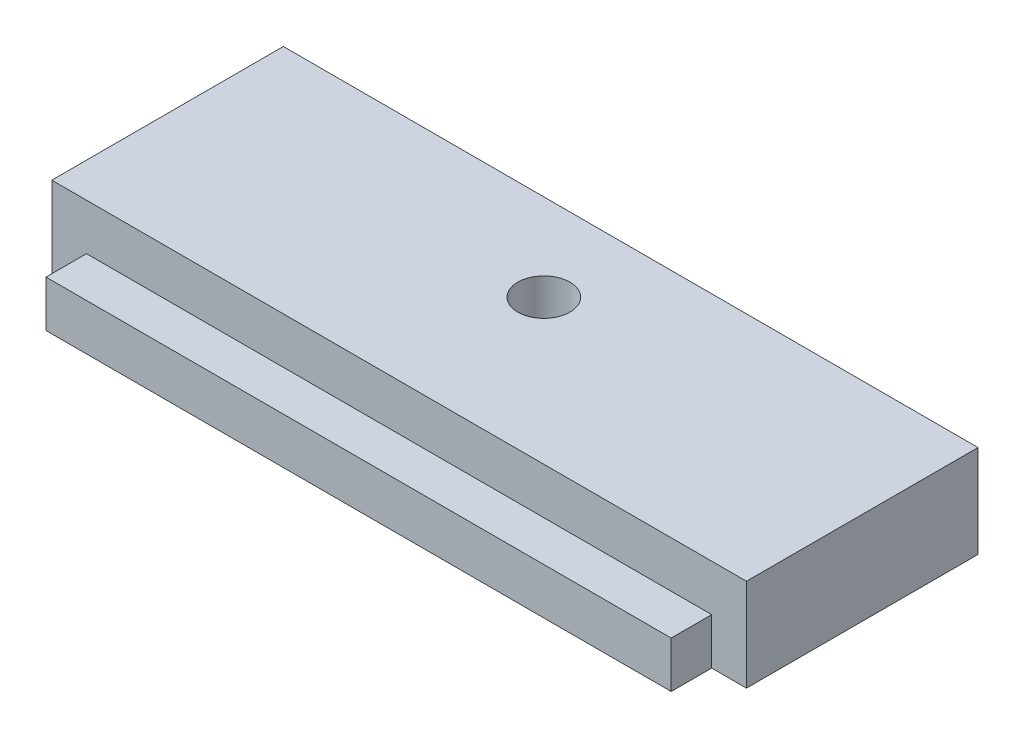
from build123d import *

# Parameters (mm, degrees)
SKETCH_1_W          = 54
SKETCH_1_H          = 4
EXTRUDE_2_DEPTH     = 3.5
SKETCH_2_W          = 60
SKETCH_2_H          = 11
EXTRUDE_3_DEPTH     = 5
SKETCH_3_W          = 60
SKETCH_3_H          = 3
CUT_EXTRUDE_1_DEPTH = 10
SKETCH_4_W          = 60
SKETCH_4_H          = 8
EXTRUDE_4_DEPTH     = 15
SKETCH_5_R          = 2.25
CUT_EXTRUDE_2_DEPTH = 64.749509802


with BuildPart() as part:
    # 스케치1 → 보스-돌출2 (new body)
    with BuildSketch(Plane.XY):
        with Locations((30, 2)):
            Rectangle(SKETCH_1_W, SKETCH_1_H)
    extrude(amount=EXTRUDE_2_DEPTH)

    # 스케치2 → 보스-돌출3 (add)
    with BuildSketch(Plane(origin=(0, 0, 0), x_dir=(-1, 0, 0), z_dir=(0, 0, -1))):
        with Locations((-30, 2.5)):
            Rectangle(SKETCH_2_W, SKETCH_2_H)
    extrude(amount=EXTRUDE_3_DEPTH)

    # 스케치3 → 컷-돌출1 (cut)
    with BuildSketch(Plane.XY):
        with Locations((30, -1.5)):
            Rectangle(SKETCH_3_W, SKETCH_3_H)
    extrude(amount=-CUT_EXTRUDE_1_DEPTH, mode=Mode.SUBTRACT)

    # 스케치4 → 보스-돌출4 (add)
    with BuildSketch(Plane(origin=(0, 0, -5), x_dir=(-1, 0, 0), z_dir=(0, 0, -1))):
        with Locations((-30, 4)):
            Rectangle(SKETCH_4_W, SKETCH_4_H)
    extrude(amount=EXTRUDE_4_DEPTH)

    # 스케치5 → 컷-돌출2 (cut, through all)
    with BuildSketch(Plane(origin=(0, 8, 0), x_dir=(1, 0, 0), z_dir=(0, 1, 0))):
        with Locations(Location((30, 12.5, 0), (0, 0, 270))):
            Circle(SKETCH_5_R)
    extrude(amount=-CUT_EXTRUDE_2_DEPTH, mode=Mode.SUBTRACT)


solid = part.part
